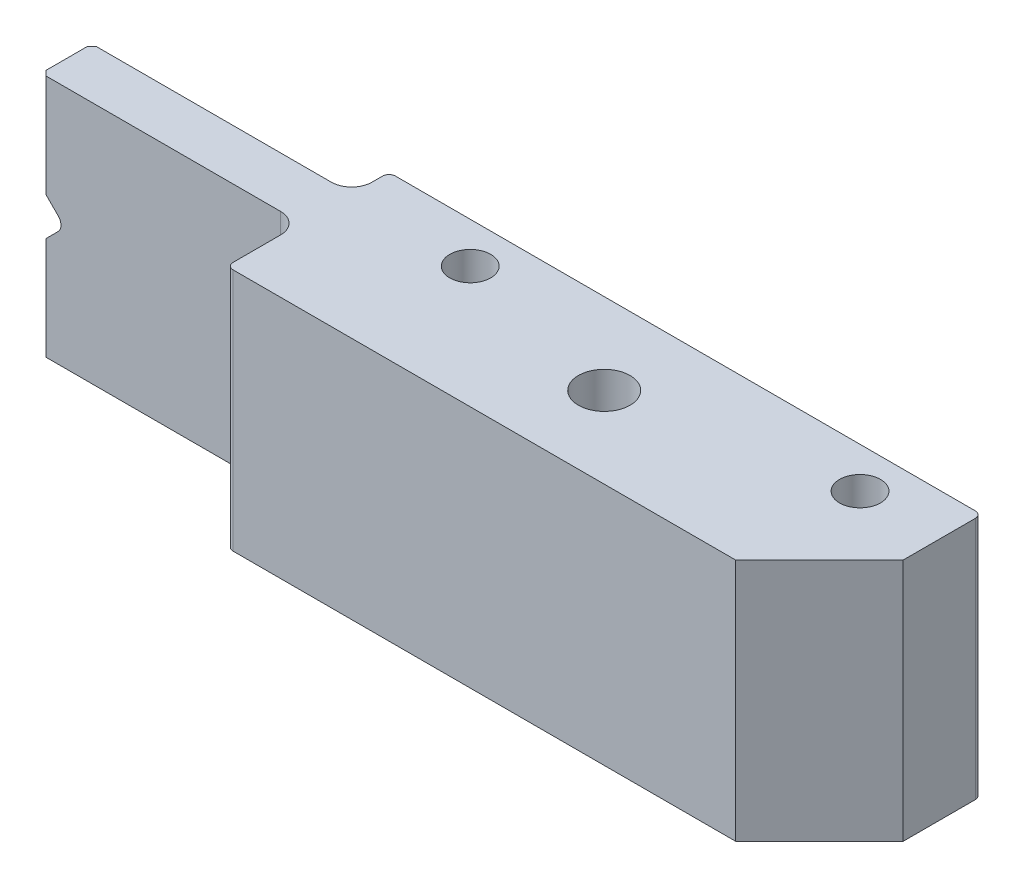
from build123d import *

# Parameters (mm, degrees)
CROQUIS1_W                          = 66.675
CROQUIS1_H                          = 19.05
SALIENTE_EXTRUIR1_DEPTH             = 12.7
CROQUIS2_W                          = 20.32
CROQUIS2_H                          = 2.921
CROQUIS2_H_2                        = 5.8166
CORTAR_EXTRUIR1_DEPTH               = 71.496440513
REDONDEO1_R                         = 1.5875
TALADROS_DE_ESPIGA_DE_1_8_0_126_1_D = 3.2004
TALADRO_ROSCADO_10_321_D            = 4.0386
CORTAR_EXTRUIR2_DEPTH               = 71.496440513
CORTAR_EXTRUIR3_DEPTH               = 71.02918653
CROQUIS10_W                         = 1.346153846
CROQUIS10_H                         = 0.358974359
CORTAR_EXTRUIR4_DEPTH               = 0.381
REDONDEO2_R                         = 0.508
CHAFL_N1_SIZE                       = 0.381


with BuildPart() as part:
    # Croquis1 → Saliente-Extruir1 (new body)
    with BuildSketch(Plane.XY):
        with Locations((33.3375, -9.525)):
            Rectangle(CROQUIS1_W, CROQUIS1_H)
    extrude(amount=SALIENTE_EXTRUIR1_DEPTH)

    # Croquis2 → Cortar-Extruir1 (cut, through all)
    with BuildSketch(Plane(origin=(0, 0, 0), x_dir=(1, 0, 0), z_dir=(0, 1, 0))):
        with Locations((10.16, -1.4605)):
            Rectangle(CROQUIS2_W, CROQUIS2_H)
        with Locations((10.16, -9.7917)):
            Rectangle(CROQUIS2_W, CROQUIS2_H_2)
    extrude(amount=-CORTAR_EXTRUIR1_DEPTH, mode=Mode.SUBTRACT)

    # Redondeo1
    redondeo1_edges = [part.edges().sort_by_distance(p)[0] for p in [
        (20.32, -9.525, 2.921),
        (20.32, -9.525, 6.8834),
    ]]
    fillet(redondeo1_edges, radius=REDONDEO1_R)

    # Taladros de espiga de 1/8 (0.126)1 (through all)
    with Locations(Plane(origin=(0, 0, 0), x_dir=(1, 0, 0), z_dir=(0, 1, 0))):
        with Locations((60.325, -3.175), (29.845, -3.175)):
            Hole(TALADROS_DE_ESPIGA_DE_1_8_0_126_1_D / 2)

    # Taladro roscado #10-321 (through all)
    with Locations(Plane(origin=(0, 0, 0), x_dir=(1, 0, 0), z_dir=(0, 1, 0))):
        with Locations((43.4975, -6.35)):
            Hole(TALADRO_ROSCADO_10_321_D / 2)

    # Croquis7 → Cortar-Extruir2 (cut, through all)
    with BuildSketch(Plane(origin=(0, 0, 0), x_dir=(1, 0, 0), z_dir=(0, 1, 0))):
        Polygon((66.675, -6.1468), (60.1218, -12.7), (66.675, -12.7), align=None)
    extrude(amount=-CORTAR_EXTRUIR2_DEPTH, mode=Mode.SUBTRACT)

    # Croquis8 → Cortar-Extruir3 (cut, through all)
    with BuildSketch(Plane(origin=(0, 0, 2.921), x_dir=(-1, 0, 0), z_dir=(0, 0, -1))):
        with BuildLine():
            Line((0, -7.659969265), (-1.326215367, -8.986184633))
            ThreePointArc((-1.326215367, -8.986184633), (-1.5494, -9.525), (-1.326215367, -10.063815367))
            Line((-1.326215367, -10.063815367), (0, -11.390030735))
            Line((0, -11.390030735), (0, -7.659969265))
        make_face()
    extrude(amount=-CORTAR_EXTRUIR3_DEPTH, mode=Mode.SUBTRACT)

    # Croquis10 → Cortar-Extruir4 (cut)
    # profile 1 of 12: a face of its own
    with BuildSketch(Plane(origin=(0, 0, 0), x_dir=(-1, 0, 0), z_dir=(0, 0, -1))):
        Polygon((-61.432842809, -12.7), (-60.970803546, -9.2), (-60.925931751, -9.2), (-59.480919732, -12.071794872), (-58.039413321, -9.2), (-57.993840405, -9.2), (-57.528996655, -12.7), (-57.844501463, -12.7), (-58.17963768, -10.181570513), (-59.443059155, -12.7), (-59.513872456, -12.7), (-60.782201783, -10.175961538), (-61.116636879, -12.7), align=None)
    # profile 2 of 12: a face of its own
    with BuildSketch(Plane(origin=(0, 0, 0), x_dir=(-1, 0, 0), z_dir=(0, 0, -1))):
        Polygon((-56.990535116, -12.7), (-56.528495854, -9.2), (-56.483624059, -9.2), (-55.038612039, -12.071794872), (-53.597105629, -9.2), (-53.551532713, -9.2), (-53.086688963, -12.7), (-53.40219377, -12.7), (-53.737329988, -10.181570513), (-55.000751463, -12.7), (-55.071564764, -12.7), (-56.339894091, -10.175961538), (-56.674329187, -12.7), align=None)
    # profile 3 of 12: a face of its own
    with BuildSketch(Plane(origin=(0, 0, 0), x_dir=(-1, 0, 0), z_dir=(0, 0, -1))):
        with BuildLine():
            Line((-50.57386845, -12.78974359), (-50.824870052, -12.615164263))
            Line((-50.824870052, -12.615164263), (-49.851713001, -11.192588141))
            add(Edge.make_bspline(
                [(-49.851713001, -11.192588141), (-49.913803737, -11.200181204), (-50.036063857, -11.215132369), (-50.159200959, -11.217879024), (-50.219801943, -11.219230769)],
                knots=[0, 0, 0, 0, 1.015715272, 2, 2, 2, 2], degree=3))
            add(Edge.make_bspline(
                [(-50.219801943, -11.219230769), (-50.256543991, -11.218289693), (-50.328665418, -11.216442442), (-50.43469707, -11.201800634), (-50.536582631, -11.179250506), (-50.634051987, -11.145601751), (-50.727471492, -11.103783542), (-50.816637205, -11.051926528), (-50.901429096, -10.990920237), (-50.980936506, -10.921087245), (-51.053248245, -10.844409193), (-51.117671542, -10.76325355), (-51.171212674, -10.676677579), (-51.21568926, -10.586447359), (-51.249419713, -10.491266009), (-51.273982251, -10.392216608), (-51.289104605, -10.288604966), (-51.290903701, -10.218079836), (-51.291817168, -10.182271635)],
                knots=[0, 0, 0, 0, 1.060718605, 2.082097864, 3.085795603, 4.069760067, 5.054557537, 6.03741023, 7.043284206, 8.066802108, 9.088538119, 10.083643548, 11.053783639, 12.022749082, 12.983451788, 13.964007469, 14.966251758, 16, 16, 16, 16], degree=3))
            add(Edge.make_bspline(
                [(-51.291817168, -10.182271635), (-51.290082733, -10.133302982), (-51.286678389, -10.03718745), (-51.259279872, -9.896753681), (-51.214219533, -9.763967138), (-51.151391156, -9.639176944), (-51.072256435, -9.524178205), (-50.977147844, -9.420569595), (-50.86664388, -9.329824742), (-50.743261861, -9.251820664), (-50.60990884, -9.189085667), (-50.470240182, -9.142846366), (-50.325326062, -9.115647619), (-50.227158392, -9.112061757), (-50.177734636, -9.11025641)],
                knots=[0, 0, 0, 0, 1.022988612, 2.007919123, 2.978103895, 3.94594894, 4.918897164, 5.887013414, 6.875921846, 7.89917871, 8.930658928, 9.948724884, 10.967259574, 12, 12, 12, 12], degree=3))
            add(Edge.make_bspline(
                [(-50.177734636, -9.11025641), (-50.129246216, -9.112086573), (-50.033437669, -9.115702803), (-49.892548663, -9.142186772), (-49.757607646, -9.186823445), (-49.629362659, -9.248508009), (-49.510623247, -9.325828916), (-49.403847436, -9.41796344), (-49.311471896, -9.524968967), (-49.233648016, -9.644257457), (-49.171177975, -9.772424439), (-49.126105692, -9.906208361), (-49.098360053, -10.044647082), (-49.094863726, -10.138441556), (-49.093099219, -10.185777244)],
                knots=[0, 0, 0, 0, 1.026385292, 2.028040595, 3.023318987, 4.028184125, 5.03290303, 6.015178782, 7.004435299, 8.016004309, 9.023023918, 10.015172535, 10.998308025, 12, 12, 12, 12], degree=3))
            add(Edge.make_bspline(
                [(-49.093099219, -10.185777244), (-49.094277628, -10.222521011), (-49.096667736, -10.297046551), (-49.113404043, -10.410276894), (-49.141824228, -10.525728124), (-49.174075927, -10.623449719), (-49.205208094, -10.704158169), (-49.234509226, -10.767909749), (-49.26702138, -10.835011013), (-49.304940145, -10.90475835), (-49.345702442, -10.978040885), (-49.391761718, -11.054123601), (-49.44206729, -11.133108594), (-49.47789701, -11.186355682), (-49.496244251, -11.213621795)],
                knots=[0, 0, 0, 0, 1.179839688, 2.393009684, 3.667231171, 4.993948276, 5.694988576, 6.444077775, 7.246288328, 8.089075292, 8.993003841, 9.939041771, 10.944649915, 12, 12, 12, 12], degree=3))
            Line((-49.496244251, -11.213621795), (-50.57386845, -12.78974359))
        make_face()
        with BuildLine():
            add(Edge.make_bspline(
                [(-50.161608834, -10.86025641), (-50.13377482, -10.859496026), (-50.079591457, -10.858015818), (-50.000214158, -10.849006576), (-49.925289955, -10.83303259), (-49.854618705, -10.810112878), (-49.787491803, -10.782456209), (-49.724975475, -10.747244223), (-49.6670174, -10.705227588), (-49.613229473, -10.658017572), (-49.565465473, -10.605566989), (-49.522922443, -10.550669882), (-49.486761875, -10.493085272), (-49.458198598, -10.43209201), (-49.434714023, -10.369174801), (-49.418496011, -10.303320446), (-49.409511677, -10.234872045), (-49.407980102, -10.188373387), (-49.407201783, -10.16474359)],
                knots=[0, 0, 0, 0, 1.163407946, 2.26475976, 3.333800367, 4.359385343, 5.366239384, 6.363380779, 7.350133999, 8.353570782, 9.349036268, 10.310270964, 11.253520213, 12.184142, 13.120487599, 14.056272588, 15.012232024, 16, 16, 16, 16], degree=3))
            add(Edge.make_bspline(
                [(-49.407201783, -10.16474359), (-49.407871452, -10.141103925), (-49.409191117, -10.094519065), (-49.419778417, -10.025969325), (-49.43840364, -9.960276064), (-49.463394125, -9.897079634), (-49.496314363, -9.836899262), (-49.535817849, -9.77897939), (-49.582750298, -9.723687262), (-49.636752865, -9.672323279), (-49.694987418, -9.62497538), (-49.757047918, -9.583189304), (-49.822422834, -9.548168107), (-49.890713324, -9.519269137), (-49.962061673, -9.496717362), (-50.036425661, -9.480499997), (-50.114181066, -9.471528243), (-50.166962352, -9.470006348), (-50.193860437, -9.469230769)],
                knots=[0, 0, 0, 0, 0.972161553, 1.915763587, 2.844109794, 3.775983486, 4.705125789, 5.659731448, 6.655561913, 7.682237399, 8.721216875, 9.739758359, 10.754845918, 11.767244016, 12.7857855, 13.828538656, 14.893392813, 16, 16, 16, 16], degree=3))
            add(Edge.make_bspline(
                [(-50.193860437, -9.469230769), (-50.22052459, -9.470007601), (-50.27283944, -9.471531738), (-50.349903599, -9.480482943), (-50.423764767, -9.496826428), (-50.494906387, -9.519258691), (-50.563194848, -9.548170263), (-50.62856668, -9.583191139), (-50.690641697, -9.624965761), (-50.748820418, -9.672360533), (-50.80291834, -9.72344818), (-50.849043869, -9.779221608), (-50.888637761, -9.836869133), (-50.921512764, -9.897087641), (-50.946515281, -9.960273927), (-50.965137283, -10.025969904), (-50.975725448, -10.094518914), (-50.977044995, -10.141103874), (-50.977714604, -10.16474359)],
                knots=[0, 0, 0, 0, 1.099389452, 2.15699305, 3.192601482, 4.213358962, 5.227959689, 6.245255729, 7.266013209, 8.307253147, 9.336162325, 10.327954924, 11.284637477, 12.215801273, 13.149702402, 14.080068371, 15.025723358, 16, 16, 16, 16], degree=3))
            add(Edge.make_bspline(
                [(-50.977714604, -10.16474359), (-50.977108677, -10.188391788), (-50.97591368, -10.235030365), (-50.964385891, -10.303556758), (-50.945107611, -10.369244952), (-50.91928822, -10.432733659), (-50.88528663, -10.493405517), (-50.843562782, -10.550972879), (-50.794657236, -10.606088329), (-50.739223748, -10.657895541), (-50.678555587, -10.705447716), (-50.613758841, -10.746978098), (-50.545949004, -10.782050543), (-50.474887374, -10.810191927), (-50.401100574, -10.83280359), (-50.323925442, -10.848977135), (-50.243617205, -10.857929402), (-50.189207223, -10.859473299), (-50.161608834, -10.86025641)],
                knots=[0, 0, 0, 0, 0.952633368, 1.87876736, 2.791047057, 3.707742249, 4.635551637, 5.587206343, 6.568248508, 7.601284464, 8.641511608, 9.671105535, 10.699146789, 11.713763218, 12.747829548, 13.806491675, 14.887386225, 16, 16, 16, 16], degree=3))
        make_face(mode=Mode.SUBTRACT)
    # profile 4 of 12: a face of its own
    with BuildSketch(Plane(origin=(0, 0, 0), x_dir=(-1, 0, 0), z_dir=(0, 0, -1))):
        with BuildLine():
            add(Edge.make_bspline(
                [(-48.64438127, -10.951402244), (-48.644053252, -10.895304856), (-48.643416072, -10.786334872), (-48.636327651, -10.62755023), (-48.624552309, -10.478589941), (-48.608414936, -10.339446875), (-48.588776956, -10.21008511), (-48.562561469, -10.090850353), (-48.532748667, -9.981190746), (-48.498196221, -9.880748698), (-48.459208432, -9.788170995), (-48.416774171, -9.701745793), (-48.369209377, -9.621603861), (-48.319232464, -9.546466071), (-48.264820392, -9.477562376), (-48.207521602, -9.413919713), (-48.145099725, -9.357008963), (-48.079676717, -9.305162661), (-48.010660253, -9.259713189), (-47.940017586, -9.21968045), (-47.867262481, -9.185480583), (-47.792196298, -9.158590147), (-47.71549374, -9.1363793), (-47.636886673, -9.121190353), (-47.556245309, -9.111633444), (-47.501813874, -9.110719776), (-47.474208995, -9.11025641)],
                knots=[0, 0, 0, 0, 1.646270934, 3.197905019, 4.663502075, 6.030701355, 7.308322542, 8.50163776, 9.611534131, 10.641858119, 11.616356847, 12.558055219, 13.465016945, 14.349605745, 15.204443733, 16.039544428, 16.859896111, 17.680448484, 18.487036065, 19.28249412, 20.06191084, 20.843045899, 21.620316918, 22.403196591, 23.190181807, 24, 24, 24, 24], degree=3))
            add(Edge.make_bspline(
                [(-47.474208995, -9.11025641), (-47.446373516, -9.110744225), (-47.391017507, -9.111714336), (-47.309177132, -9.121038279), (-47.22922745, -9.136509402), (-47.151509312, -9.158430377), (-47.075384325, -9.185626053), (-47.001447917, -9.21971317), (-46.929240836, -9.259392038), (-46.859910548, -9.306015915), (-46.792695933, -9.357998191), (-46.72924797, -9.41676086), (-46.669560884, -9.481710579), (-46.612885579, -9.552152443), (-46.560829981, -9.629437528), (-46.511256549, -9.712221638), (-46.466884513, -9.801952503), (-46.424149838, -9.89713297), (-46.387262851, -10.000396629), (-46.353996606, -10.11116139), (-46.327117638, -10.230735577), (-46.304728365, -10.358491822), (-46.287383469, -10.494899305), (-46.274750827, -10.639665621), (-46.268077742, -10.792886011), (-46.266821041, -10.89764386), (-46.266176142, -10.951402244)],
                knots=[0, 0, 0, 0, 0.810914788, 1.612654377, 2.396697861, 3.181598691, 3.963628158, 4.749916497, 5.551656086, 6.361998678, 7.18212741, 8.025565596, 8.878627764, 9.750805457, 10.657531673, 11.591944965, 12.560506719, 13.57287815, 14.630710178, 15.753379473, 16.941251878, 18.199788006, 19.531962791, 20.947069417, 22.433333509, 24, 24, 24, 24], degree=3))
            add(Edge.make_bspline(
                [(-46.266176142, -10.951402244), (-46.266827727, -11.004926152), (-46.268097312, -11.109215303), (-46.274676019, -11.261746279), (-46.28763465, -11.405744322), (-46.303844639, -11.541554784), (-46.326295602, -11.668612403), (-46.353900768, -11.787356852), (-46.384551091, -11.898300923), (-46.422385885, -12.000535735), (-46.463796595, -12.095487458), (-46.508851791, -12.184154606), (-46.557121617, -12.267320899), (-46.609710362, -12.344320646), (-46.665763776, -12.415699303), (-46.726481564, -12.480196926), (-46.79015215, -12.539367598), (-46.857564565, -12.592019225), (-46.927976117, -12.63810403), (-46.999935194, -12.67931788), (-47.074718577, -12.712550575), (-47.15063153, -12.741085616), (-47.228759896, -12.762886068), (-47.309006286, -12.777959923), (-47.390962522, -12.788531772), (-47.446364087, -12.789338252), (-47.474208995, -12.78974359)],
                knots=[0, 0, 0, 0, 1.561518951, 3.042555995, 4.452378317, 5.7783523, 7.031515105, 8.214008947, 9.334062868, 10.386615937, 11.391082383, 12.354592575, 13.286541444, 14.194233754, 15.072674879, 15.931287219, 16.775624067, 17.606195743, 18.42308326, 19.229000347, 20.022332153, 20.807536673, 21.593273796, 22.3848459, 23.188221202, 24, 24, 24, 24], degree=3))
            add(Edge.make_bspline(
                [(-47.474208995, -12.78974359), (-47.501813109, -12.789277234), (-47.556243033, -12.788357672), (-47.636895459, -12.778843941), (-47.715177902, -12.763548438), (-47.791476656, -12.742131834), (-47.866183171, -12.715916997), (-47.938279458, -12.681763314), (-48.008567142, -12.642429245), (-48.076858698, -12.597633823), (-48.141870859, -12.54631214), (-48.203969464, -12.489547851), (-48.261594483, -12.42592444), (-48.315228579, -12.356446517), (-48.366202667, -12.281753275), (-48.41309204, -12.200824902), (-48.456462894, -12.113982291), (-48.496106385, -12.02066438), (-48.531255049, -11.919509453), (-48.562302757, -11.809360274), (-48.586816914, -11.689244638), (-48.607799869, -11.560127271), (-48.624724252, -11.421453341), (-48.636278578, -11.273147562), (-48.643419893, -11.115302353), (-48.644054963, -11.007032579), (-48.64438127, -10.951402244)],
                knots=[0, 0, 0, 0, 0.810891512, 1.598919785, 2.382837074, 3.152667961, 3.926044502, 4.706494248, 5.493654104, 6.291793342, 7.103789334, 7.925228297, 8.761435821, 9.622817696, 10.50288917, 11.416980706, 12.369136599, 13.353924996, 14.394355917, 15.514179734, 16.714354668, 17.994756427, 19.357759367, 20.818452758, 22.365282078, 24, 24, 24, 24], degree=3))
        make_face()
        with BuildLine():
            add(Edge.make_bspline(
                [(-48.330278706, -10.95), (-48.330159259, -10.996748699), (-48.329927436, -11.087478744), (-48.323871235, -11.219322005), (-48.315621003, -11.342292333), (-48.304979706, -11.45654587), (-48.289176757, -11.561695882), (-48.27146997, -11.658465565), (-48.24992188, -11.746342803), (-48.224426862, -11.825930613), (-48.195387765, -11.898579682), (-48.163681902, -11.966180897), (-48.129621179, -12.029532833), (-48.091502028, -12.088066442), (-48.049986965, -12.141972606), (-48.006013706, -12.192205438), (-47.957941122, -12.237002419), (-47.891437379, -12.290729274), (-47.803640905, -12.346248408), (-47.693020449, -12.394594498), (-47.579351998, -12.424976954), (-47.502200748, -12.42884071), (-47.463692168, -12.430769231)],
                knots=[0, 0, 0, 0, 1.459021318, 2.831673884, 4.118529203, 5.306027144, 6.411944654, 7.436330062, 8.375795394, 9.233974572, 10.042671642, 10.816086306, 11.563610507, 12.285937304, 12.993564865, 13.685989202, 14.367179055, 15.041617293, 16.353048772, 17.594441528, 18.799311195, 20, 20, 20, 20], degree=3))
            add(Edge.make_bspline(
                [(-47.463692168, -12.430769231), (-47.424934496, -12.42917145), (-47.347499173, -12.425979187), (-47.234365378, -12.39518045), (-47.124535108, -12.34871091), (-47.038463167, -12.293763405), (-46.972980624, -12.241435075), (-46.926063634, -12.196820427), (-46.883001585, -12.14686456), (-46.84215951, -12.092965264), (-46.804700435, -12.03409278), (-46.770637297, -11.970530204), (-46.739553949, -11.902101027), (-46.721844904, -11.854331287), (-46.712790725, -11.829907853)],
                knots=[0, 0, 0, 0, 1.353760809, 2.704726607, 4.075137775, 5.516104923, 6.260822281, 7.007110065, 7.778089737, 8.566572457, 9.372053459, 10.217411131, 11.088608312, 12, 12, 12, 12], degree=3))
            add(Edge.make_bspline(
                [(-46.712790725, -11.829907853), (-46.702238958, -11.798678113), (-46.680814344, -11.735268349), (-46.653202569, -11.636904697), (-46.63145717, -11.533701933), (-46.611893804, -11.426276816), (-46.598540749, -11.313837115), (-46.587792935, -11.196730731), (-46.581462248, -11.074869369), (-46.580677497, -10.992074378), (-46.580278706, -10.95)],
                knots=[0, 0, 0, 0, 0.884706709, 1.796334032, 2.740027952, 3.714592787, 4.726048262, 5.777819803, 6.87074269, 8, 8, 8, 8], degree=3))
            add(Edge.make_bspline(
                [(-46.580278706, -10.95), (-46.580828895, -10.907932427), (-46.581905183, -10.825639263), (-46.586019171, -10.705121082), (-46.596642745, -10.590653321), (-46.608441864, -10.481742848), (-46.625839085, -10.378992546), (-46.644596892, -10.281542241), (-46.669798104, -10.190599216), (-46.696717879, -10.104739634), (-46.727528275, -10.024938979), (-46.761444009, -9.950825193), (-46.797665768, -9.882040468), (-46.837008008, -9.818773527), (-46.879003691, -9.760740984), (-46.924761241, -9.709106389), (-46.972465613, -9.662269421), (-47.039282799, -9.608806852), (-47.126757089, -9.554295157), (-47.235602736, -9.504129397), (-47.348873381, -9.475321104), (-47.425446835, -9.471259417), (-47.463692168, -9.469230769)],
                knots=[0, 0, 0, 0, 1.31362396, 2.569729283, 3.763502607, 4.902122613, 5.988968491, 7.01645872, 7.998833611, 8.933434873, 9.825090667, 10.667526885, 11.477055099, 12.250526234, 12.991942729, 13.710640831, 14.402115721, 15.076753259, 16.378508321, 17.609869233, 18.806226677, 20, 20, 20, 20], degree=3))
            add(Edge.make_bspline(
                [(-47.463692168, -9.469230769), (-47.50240276, -9.471262216), (-47.579894465, -9.47532881), (-47.69434242, -9.504022064), (-47.804046772, -9.55403503), (-47.891289746, -9.608987402), (-47.958153533, -9.661325713), (-48.005236226, -9.706712167), (-48.049382398, -9.756358422), (-48.090050099, -9.810760337), (-48.128139382, -9.869225704), (-48.163120394, -9.932214469), (-48.194637724, -10.000045833), (-48.22372226, -10.072662268), (-48.249295048, -10.152243213), (-48.270389012, -10.240012206), (-48.289876065, -10.336474098), (-48.303671334, -10.442193606), (-48.315935089, -10.55647576), (-48.323816437, -10.679753078), (-48.329947695, -10.811817458), (-48.330166159, -10.903016617), (-48.330278706, -10.95)],
                knots=[0, 0, 0, 0, 1.207732386, 2.417664972, 3.655092373, 4.956220595, 5.625982001, 6.301752483, 6.994047911, 7.697131622, 8.419323945, 9.170223765, 9.943494443, 10.752040957, 11.610060368, 12.549350801, 13.567764191, 14.679664412, 15.874934091, 17.154273443, 18.533957287, 20, 20, 20, 20], degree=3))
        make_face(mode=Mode.SUBTRACT)
    # profile 5 of 12: a face of its own
    with BuildSketch(Plane(origin=(0, 0, 0), x_dir=(-1, 0, 0), z_dir=(0, 0, -1))):
        with Locations((-45.278996655, -11.353846154)):
            Rectangle(CROQUIS10_W, CROQUIS10_H)
    # profile 6 of 12: a face of its own
    with BuildSketch(Plane(origin=(0, 0, 0), x_dir=(-1, 0, 0), z_dir=(0, 0, -1))):
        Polygon((-42.426132071, -9.11025641), (-42.362329988, -9.11025641), (-42.362329988, -11.533333333), (-41.958483834, -11.533333333), (-41.958483834, -11.892307692), (-42.362329988, -11.892307692), (-42.362329988, -12.7), (-42.676432552, -12.7), (-42.676432552, -11.892307692), (-44.336688963, -11.892307692), align=None)
        Polygon((-42.676432552, -11.533333333), (-42.676432552, -10.013301282), (-43.719701783, -11.533333333), align=None, mode=Mode.SUBTRACT)
    # profile 7 of 12: a face of its own
    with BuildSketch(Plane(origin=(0, 0, 0), x_dir=(-1, 0, 0), z_dir=(0, 0, -1))):
        Polygon((-40.900491046, -9.2), (-40.253355629, -9.2), (-40.253355629, -12.7), (-40.567458193, -12.7), (-40.567458193, -9.558974359), (-41.105919732, -9.558974359), align=None)
    # profile 8 of 12: a face of its own
    with BuildSketch(Plane(origin=(0, 0, 0), x_dir=(-1, 0, 0), z_dir=(0, 0, -1))):
        with BuildLine():
            Line((-36.753355629, -9.2), (-36.753355629, -9.558974359))
            Line((-36.753355629, -9.558974359), (-37.943860437, -9.558974359))
            Line((-37.943860437, -9.558974359), (-38.1324622, -10.479547276))
            add(Edge.make_bspline(
                [(-38.1324622, -10.479547276), (-38.095406325, -10.469317004), (-38.023616429, -10.44949747), (-37.917656569, -10.4274917), (-37.817064365, -10.414226256), (-37.751788995, -10.412414945), (-37.720202584, -10.411538462)],
                knots=[0, 0, 0, 0, 1.100273476, 2.13160584, 3.095893838, 4, 4, 4, 4], degree=3))
            add(Edge.make_bspline(
                [(-37.720202584, -10.411538462), (-37.681118845, -10.412384397), (-37.604270447, -10.414047718), (-37.4918315, -10.430019568), (-37.384498607, -10.455159482), (-37.282496237, -10.490280004), (-37.185635686, -10.535189737), (-37.094808125, -10.591289678), (-37.008650212, -10.656823009), (-36.928707618, -10.732168021), (-36.85618331, -10.815089637), (-36.79241732, -10.904247508), (-36.73825473, -10.998775171), (-36.694693975, -11.099575779), (-36.659909641, -11.205534933), (-36.636757646, -11.317767515), (-36.621340937, -11.435215635), (-36.61961855, -11.515520205), (-36.618740245, -11.556470353)],
                knots=[0, 0, 0, 0, 1.052922333, 2.070308379, 3.05430497, 4.020497103, 4.973039431, 5.925935799, 6.892292201, 7.88610001, 8.88166317, 9.857072816, 10.836096531, 11.812156883, 12.81219415, 13.836441305, 14.89672472, 16, 16, 16, 16], degree=3))
            add(Edge.make_bspline(
                [(-36.618740245, -11.556470353), (-36.61940532, -11.584992573), (-36.620726482, -11.64165156), (-36.62744507, -11.725795761), (-36.640380786, -11.808158594), (-36.65774851, -11.888750986), (-36.680290928, -11.967420358), (-36.707579982, -12.044391886), (-36.74097601, -12.119186493), (-36.777607385, -12.192511888), (-36.818853863, -12.262710395), (-36.86463237, -12.328359382), (-36.912997862, -12.390443663), (-36.965039247, -12.448297396), (-37.021240242, -12.501540414), (-37.080920209, -12.550488696), (-37.143602928, -12.595970026), (-37.21025817, -12.636138221), (-37.279400653, -12.673101177), (-37.35202887, -12.703424715), (-37.426489571, -12.730535243), (-37.503854446, -12.75214477), (-37.583948259, -12.769077325), (-37.666903035, -12.780577925), (-37.752283705, -12.788954363), (-37.810158717, -12.78947872), (-37.839393289, -12.78974359)],
                knots=[0, 0, 0, 0, 1.056347294, 2.098418968, 3.122841568, 4.141288669, 5.149314143, 6.15115421, 7.162517403, 8.180376062, 9.185164535, 10.17417709, 11.141909838, 12.097768115, 13.052685741, 14.0056014, 14.954263652, 15.917497458, 16.885230207, 17.854509472, 18.828990115, 19.81800267, 20.826176721, 21.857883937, 22.917946725, 24, 24, 24, 24], degree=3))
            add(Edge.make_bspline(
                [(-37.839393289, -12.78974359), (-37.87426747, -12.789052752), (-37.942878301, -12.78769361), (-38.043398868, -12.773475124), (-38.140113474, -12.753111208), (-38.232243575, -12.722474938), (-38.320614838, -12.684087643), (-38.404037556, -12.635571472), (-38.484643332, -12.580592368), (-38.559155369, -12.515712015), (-38.628311483, -12.444796333), (-38.690217991, -12.367838692), (-38.745351568, -12.28610925), (-38.792829315, -12.199211096), (-38.833327336, -12.107372565), (-38.865142325, -12.010249564), (-38.89082068, -11.90834956), (-38.9016841, -11.83819605), (-38.907201783, -11.802564103)],
                knots=[0, 0, 0, 0, 1.0467383, 2.05933395, 3.04377827, 4.011590433, 4.970194871, 5.932262533, 6.905835911, 7.896367577, 8.894135286, 9.877477877, 10.858688626, 11.851381753, 12.8477658, 13.868841284, 14.917554742, 16, 16, 16, 16], degree=3))
            Line((-38.907201783, -11.802564103), (-38.593099219, -11.802564103))
            add(Edge.make_bspline(
                [(-38.593099219, -11.802564103), (-38.585370662, -11.835940555), (-38.570515945, -11.90009195), (-38.537910196, -11.990223291), (-38.498044321, -12.070542515), (-38.450639972, -12.142112098), (-38.394089942, -12.204521095), (-38.329560513, -12.260138157), (-38.25721279, -12.310313287), (-38.17681956, -12.352136054), (-38.092006481, -12.387804807), (-38.003239271, -12.411556502), (-37.912934925, -12.428257395), (-37.851856554, -12.429929156), (-37.821164123, -12.430769231)],
                knots=[0, 0, 0, 0, 1.136247022, 2.183929868, 3.172523383, 4.106158343, 5.02341133, 5.958108904, 6.928429099, 7.938127109, 8.96079061, 9.975095812, 10.982467395, 12, 12, 12, 12], degree=3))
            add(Edge.make_bspline(
                [(-37.821164123, -12.430769231), (-37.791205678, -12.429948453), (-37.732217256, -12.428332334), (-37.645405869, -12.415893322), (-37.561592995, -12.396735751), (-37.481605639, -12.368065896), (-37.404044099, -12.333221178), (-37.330870329, -12.288506102), (-37.259967451, -12.237046083), (-37.193539318, -12.178089453), (-37.132699869, -12.113119759), (-37.078943747, -12.043642365), (-37.034166834, -11.969525519), (-36.996432725, -11.892052366), (-36.967779426, -11.810373809), (-36.947338445, -11.724872634), (-36.935335386, -11.635337653), (-36.933684206, -11.574268344), (-36.932842809, -11.543149038)],
                knots=[0, 0, 0, 0, 1.027316725, 2.022795036, 3.002884548, 3.971462791, 4.93288096, 5.914575861, 6.907176829, 7.935150275, 8.956128384, 9.956726525, 10.942570165, 11.921478529, 12.907843606, 13.90538589, 14.932640048, 16, 16, 16, 16], degree=3))
            add(Edge.make_bspline(
                [(-36.932842809, -11.543149038), (-36.933501288, -11.515073287), (-36.934790168, -11.460118998), (-36.945320738, -11.379719791), (-36.963637711, -11.303646749), (-36.989061591, -11.231532515), (-37.021341098, -11.163309073), (-37.060787411, -11.098906013), (-37.108140809, -11.039172179), (-37.162232697, -10.984079626), (-37.221490738, -10.933234751), (-37.286934481, -10.889890664), (-37.357194408, -10.853426747), (-37.431424007, -10.821958748), (-37.511388906, -10.799358003), (-37.595505538, -10.782390118), (-37.684682246, -10.772574755), (-37.745652934, -10.771212866), (-37.77699345, -10.770512821)],
                knots=[0, 0, 0, 0, 1.045622112, 2.046656509, 3.013763289, 3.955457236, 4.890082067, 5.820317437, 6.762574623, 7.722996705, 8.69280354, 9.665887285, 10.63943826, 11.638615906, 12.663482002, 13.728887084, 14.832589034, 16, 16, 16, 16], degree=3))
            add(Edge.make_bspline(
                [(-37.77699345, -10.770512821), (-37.804122379, -10.771093412), (-37.860136734, -10.772292185), (-37.946059561, -10.781118682), (-38.036351284, -10.795357976), (-38.130665779, -10.814944224), (-38.229286287, -10.840575301), (-38.332004688, -10.871289801), (-38.439036955, -10.9080118), (-38.511154679, -10.935744014), (-38.548227424, -10.95)],
                knots=[0, 0, 0, 0, 0.817624296, 1.688186739, 2.600797293, 3.572016777, 4.590301741, 5.671205678, 6.80286297, 8, 8, 8, 8], degree=3))
            Line((-38.548227424, -10.95), (-38.189253065, -9.2))
            Line((-38.189253065, -9.2), (-36.753355629, -9.2))
        make_face()
    # profile 9 of 12: a face of its own
    with BuildSketch(Plane(origin=(0, 0, 0), x_dir=(-1, 0, 0), z_dir=(0, 0, -1))):
        with BuildLine():
            add(Edge.make_bspline(
                [(-36.259765886, -10.951402244), (-36.259437867, -10.895304856), (-36.258800687, -10.786334872), (-36.251712266, -10.62755023), (-36.239936924, -10.478589941), (-36.223799551, -10.339446875), (-36.204161571, -10.21008511), (-36.177946085, -10.090850353), (-36.148133282, -9.981190746), (-36.113580836, -9.880748698), (-36.074593047, -9.788170995), (-36.032158786, -9.701745793), (-35.984593992, -9.621603861), (-35.934617079, -9.546466071), (-35.880205007, -9.477562376), (-35.822906217, -9.413919713), (-35.760484341, -9.357008963), (-35.695061332, -9.305162661), (-35.626044868, -9.259713189), (-35.555402202, -9.21968045), (-35.482647096, -9.185480583), (-35.407580913, -9.158590147), (-35.330878355, -9.1363793), (-35.252271288, -9.121190353), (-35.171629925, -9.111633444), (-35.11719849, -9.110719776), (-35.08959361, -9.11025641)],
                knots=[0, 0, 0, 0, 1.646270934, 3.197905019, 4.663502075, 6.030701355, 7.308322542, 8.50163776, 9.611534131, 10.641858119, 11.616356847, 12.558055219, 13.465016945, 14.349605745, 15.204443733, 16.039544428, 16.859896111, 17.680448484, 18.487036065, 19.28249412, 20.06191084, 20.843045899, 21.620316918, 22.403196591, 23.190181807, 24, 24, 24, 24], degree=3))
            add(Edge.make_bspline(
                [(-35.08959361, -9.11025641), (-35.061758131, -9.110744225), (-35.006402123, -9.111714336), (-34.924561747, -9.121038279), (-34.844612066, -9.136509402), (-34.766893927, -9.158430377), (-34.69076894, -9.185626053), (-34.616832533, -9.21971317), (-34.544625451, -9.259392038), (-34.475295164, -9.306015915), (-34.408080548, -9.357998191), (-34.344632585, -9.41676086), (-34.284945499, -9.481710579), (-34.228270194, -9.552152443), (-34.176214597, -9.629437528), (-34.126641165, -9.712221638), (-34.082269129, -9.801952503), (-34.039534454, -9.89713297), (-34.002647467, -10.000396629), (-33.969381222, -10.11116139), (-33.942502253, -10.230735577), (-33.920112981, -10.358491822), (-33.902768085, -10.494899305), (-33.890135443, -10.639665621), (-33.883462358, -10.792886011), (-33.882205656, -10.89764386), (-33.881560757, -10.951402244)],
                knots=[0, 0, 0, 0, 0.810914788, 1.612654377, 2.396697861, 3.181598691, 3.963628158, 4.749916497, 5.551656086, 6.361998678, 7.18212741, 8.025565596, 8.878627764, 9.750805457, 10.657531673, 11.591944965, 12.560506719, 13.57287815, 14.630710178, 15.753379473, 16.941251878, 18.199788006, 19.531962791, 20.947069417, 22.433333509, 24, 24, 24, 24], degree=3))
            add(Edge.make_bspline(
                [(-33.881560757, -10.951402244), (-33.882212342, -11.004926152), (-33.883481928, -11.109215303), (-33.890060635, -11.261746279), (-33.903019266, -11.405744322), (-33.919229254, -11.541554784), (-33.941680217, -11.668612403), (-33.969285383, -11.787356852), (-33.999935706, -11.898300923), (-34.0377705, -12.000535735), (-34.079181211, -12.095487458), (-34.124236407, -12.184154606), (-34.172506233, -12.267320899), (-34.225094978, -12.344320646), (-34.281148391, -12.415699303), (-34.34186618, -12.480196926), (-34.405536765, -12.539367598), (-34.472949181, -12.592019225), (-34.543360732, -12.63810403), (-34.615319809, -12.67931788), (-34.690103192, -12.712550575), (-34.766016145, -12.741085616), (-34.844144511, -12.762886068), (-34.924390902, -12.777959923), (-35.006347138, -12.788531772), (-35.061748703, -12.789338252), (-35.08959361, -12.78974359)],
                knots=[0, 0, 0, 0, 1.561518951, 3.042555995, 4.452378317, 5.7783523, 7.031515105, 8.214008947, 9.334062868, 10.386615937, 11.391082383, 12.354592575, 13.286541444, 14.194233754, 15.072674879, 15.931287219, 16.775624067, 17.606195743, 18.42308326, 19.229000347, 20.022332153, 20.807536673, 21.593273796, 22.3848459, 23.188221202, 24, 24, 24, 24], degree=3))
            add(Edge.make_bspline(
                [(-35.08959361, -12.78974359), (-35.117197724, -12.789277234), (-35.171627649, -12.788357672), (-35.252280074, -12.778843941), (-35.330562518, -12.763548438), (-35.406861272, -12.742131834), (-35.481567787, -12.715916997), (-35.553664073, -12.681763314), (-35.623951757, -12.642429245), (-35.692243313, -12.597633823), (-35.757255474, -12.54631214), (-35.819354079, -12.489547851), (-35.876979099, -12.42592444), (-35.930613194, -12.356446517), (-35.981587282, -12.281753275), (-36.028476656, -12.200824902), (-36.07184751, -12.113982291), (-36.111491, -12.02066438), (-36.146639664, -11.919509453), (-36.177687372, -11.809360274), (-36.202201529, -11.689244638), (-36.223184485, -11.560127271), (-36.240108868, -11.421453341), (-36.251663193, -11.273147562), (-36.258804508, -11.115302353), (-36.259439579, -11.007032579), (-36.259765886, -10.951402244)],
                knots=[0, 0, 0, 0, 0.810891512, 1.598919785, 2.382837074, 3.152667961, 3.926044502, 4.706494248, 5.493654104, 6.291793342, 7.103789334, 7.925228297, 8.761435821, 9.622817696, 10.50288917, 11.416980706, 12.369136599, 13.353924996, 14.394355917, 15.514179734, 16.714354668, 17.994756427, 19.357759367, 20.818452758, 22.365282078, 24, 24, 24, 24], degree=3))
        make_face()
        with BuildLine():
            add(Edge.make_bspline(
                [(-35.945663321, -10.95), (-35.945543874, -10.996748699), (-35.945312051, -11.087478744), (-35.939255851, -11.219322005), (-35.931005619, -11.342292333), (-35.920364321, -11.45654587), (-35.904561373, -11.561695882), (-35.886854585, -11.658465565), (-35.865306495, -11.746342803), (-35.839811478, -11.825930613), (-35.810772381, -11.898579682), (-35.779066517, -11.966180897), (-35.745005794, -12.029532833), (-35.706886644, -12.088066442), (-35.66537158, -12.141972606), (-35.621398321, -12.192205438), (-35.573325737, -12.237002419), (-35.506821994, -12.290729274), (-35.41902552, -12.346248408), (-35.308405065, -12.394594498), (-35.194736614, -12.424976954), (-35.117585364, -12.42884071), (-35.079076783, -12.430769231)],
                knots=[0, 0, 0, 0, 1.459021318, 2.831673884, 4.118529203, 5.306027144, 6.411944654, 7.436330062, 8.375795394, 9.233974572, 10.042671642, 10.816086306, 11.563610507, 12.285937304, 12.993564865, 13.685989202, 14.367179055, 15.041617293, 16.353048772, 17.594441528, 18.799311195, 20, 20, 20, 20], degree=3))
            add(Edge.make_bspline(
                [(-35.079076783, -12.430769231), (-35.040319111, -12.42917145), (-34.962883788, -12.425979187), (-34.849749993, -12.39518045), (-34.739919723, -12.34871091), (-34.653847783, -12.293763405), (-34.588365239, -12.241435075), (-34.541448249, -12.196820427), (-34.498386201, -12.14686456), (-34.457544126, -12.092965264), (-34.42008505, -12.03409278), (-34.386021912, -11.970530204), (-34.354938565, -11.902101027), (-34.337229519, -11.854331287), (-34.328175341, -11.829907853)],
                knots=[0, 0, 0, 0, 1.353760809, 2.704726607, 4.075137775, 5.516104923, 6.260822281, 7.007110065, 7.778089737, 8.566572457, 9.372053459, 10.217411131, 11.088608312, 12, 12, 12, 12], degree=3))
            add(Edge.make_bspline(
                [(-34.328175341, -11.829907853), (-34.317623573, -11.798678113), (-34.296198959, -11.735268349), (-34.268587185, -11.636904697), (-34.246841786, -11.533701933), (-34.22727842, -11.426276816), (-34.213925364, -11.313837115), (-34.203177551, -11.196730731), (-34.196846864, -11.074869369), (-34.196062113, -10.992074378), (-34.195663321, -10.95)],
                knots=[0, 0, 0, 0, 0.884706709, 1.796334032, 2.740027952, 3.714592787, 4.726048262, 5.777819803, 6.87074269, 8, 8, 8, 8], degree=3))
            add(Edge.make_bspline(
                [(-34.195663321, -10.95), (-34.196213511, -10.907932427), (-34.197289798, -10.825639263), (-34.201403786, -10.705121082), (-34.212027361, -10.590653321), (-34.22382648, -10.481742848), (-34.241223701, -10.378992546), (-34.259981508, -10.281542241), (-34.28518272, -10.190599216), (-34.312102495, -10.104739634), (-34.34291289, -10.024938979), (-34.376828625, -9.950825193), (-34.413050383, -9.882040468), (-34.452392624, -9.818773527), (-34.494388307, -9.760740984), (-34.540145856, -9.709106389), (-34.587850229, -9.662269421), (-34.654667415, -9.608806852), (-34.742141704, -9.554295157), (-34.850987352, -9.504129397), (-34.964257996, -9.475321104), (-35.04083145, -9.471259417), (-35.079076783, -9.469230769)],
                knots=[0, 0, 0, 0, 1.31362396, 2.569729283, 3.763502607, 4.902122613, 5.988968491, 7.01645872, 7.998833611, 8.933434873, 9.825090667, 10.667526885, 11.477055099, 12.250526234, 12.991942729, 13.710640831, 14.402115721, 15.076753259, 16.378508321, 17.609869233, 18.806226677, 20, 20, 20, 20], degree=3))
            add(Edge.make_bspline(
                [(-35.079076783, -9.469230769), (-35.117787375, -9.471262216), (-35.195279081, -9.47532881), (-35.309727035, -9.504022064), (-35.419431387, -9.55403503), (-35.506674362, -9.608987402), (-35.573538148, -9.661325713), (-35.620620842, -9.706712167), (-35.664767014, -9.756358422), (-35.705434714, -9.810760337), (-35.743523997, -9.869225704), (-35.77850501, -9.932214469), (-35.810022339, -10.000045833), (-35.839106876, -10.072662268), (-35.864679664, -10.152243213), (-35.885773627, -10.240012206), (-35.90526068, -10.336474098), (-35.919055949, -10.442193606), (-35.931319705, -10.55647576), (-35.939201053, -10.679753078), (-35.94533231, -10.811817458), (-35.945550774, -10.903016617), (-35.945663321, -10.95)],
                knots=[0, 0, 0, 0, 1.207732386, 2.417664972, 3.655092373, 4.956220595, 5.625982001, 6.301752483, 6.994047911, 7.697131622, 8.419323945, 9.170223765, 9.943494443, 10.752040957, 11.610060368, 12.549350801, 13.567764191, 14.679664412, 15.874934091, 17.154273443, 18.533957287, 20, 20, 20, 20], degree=3))
        make_face(mode=Mode.SUBTRACT)
    # profile 10 of 12: a face of its own
    with BuildSketch(Plane(origin=(0, 0, 0), x_dir=(-1, 0, 0), z_dir=(0, 0, -1))):
        with Locations((-32.89438127, -11.353846154)):
            Rectangle(CROQUIS10_W, CROQUIS10_H)
    # profile 11 of 12: a face of its own
    with BuildSketch(Plane(origin=(0, 0, 0), x_dir=(-1, 0, 0), z_dir=(0, 0, -1))):
        with BuildLine():
            add(Edge.make_bspline(
                [(-31.952073578, -10.951402244), (-31.95174556, -10.895304856), (-31.95110838, -10.786334872), (-31.944019959, -10.62755023), (-31.932244616, -10.478589941), (-31.916107244, -10.339446875), (-31.896469263, -10.21008511), (-31.870253777, -10.090850353), (-31.840440974, -9.981190746), (-31.805888528, -9.880748698), (-31.766900739, -9.788170995), (-31.724466479, -9.701745793), (-31.676901684, -9.621603861), (-31.626924771, -9.546466071), (-31.5725127, -9.477562376), (-31.515213909, -9.413919713), (-31.452792033, -9.357008963), (-31.387369025, -9.305162661), (-31.31835256, -9.259713189), (-31.247709894, -9.21968045), (-31.174954788, -9.185480583), (-31.099888605, -9.158590147), (-31.023186047, -9.1363793), (-30.944578981, -9.121190353), (-30.863937617, -9.111633444), (-30.809506182, -9.110719776), (-30.781901302, -9.11025641)],
                knots=[0, 0, 0, 0, 1.646270934, 3.197905019, 4.663502075, 6.030701355, 7.308322542, 8.50163776, 9.611534131, 10.641858119, 11.616356847, 12.558055219, 13.465016945, 14.349605745, 15.204443733, 16.039544428, 16.859896111, 17.680448484, 18.487036065, 19.28249412, 20.06191084, 20.843045899, 21.620316918, 22.403196591, 23.190181807, 24, 24, 24, 24], degree=3))
            add(Edge.make_bspline(
                [(-30.781901302, -9.11025641), (-30.754065824, -9.110744225), (-30.698709815, -9.111714336), (-30.61686944, -9.121038279), (-30.536919758, -9.136509402), (-30.459201619, -9.158430377), (-30.383076633, -9.185626053), (-30.309140225, -9.21971317), (-30.236933143, -9.259392038), (-30.167602856, -9.306015915), (-30.100388241, -9.357998191), (-30.036940278, -9.41676086), (-29.977253192, -9.481710579), (-29.920577886, -9.552152443), (-29.868522289, -9.629437528), (-29.818948857, -9.712221638), (-29.774576821, -9.801952503), (-29.731842146, -9.89713297), (-29.694955159, -10.000396629), (-29.661688914, -10.11116139), (-29.634809945, -10.230735577), (-29.612420673, -10.358491822), (-29.595075777, -10.494899305), (-29.582443135, -10.639665621), (-29.57577005, -10.792886011), (-29.574513349, -10.89764386), (-29.57386845, -10.951402244)],
                knots=[0, 0, 0, 0, 0.810914788, 1.612654377, 2.396697861, 3.181598691, 3.963628158, 4.749916497, 5.551656086, 6.361998678, 7.18212741, 8.025565596, 8.878627764, 9.750805457, 10.657531673, 11.591944965, 12.560506719, 13.57287815, 14.630710178, 15.753379473, 16.941251878, 18.199788006, 19.531962791, 20.947069417, 22.433333509, 24, 24, 24, 24], degree=3))
            add(Edge.make_bspline(
                [(-29.57386845, -10.951402244), (-29.574520034, -11.004926152), (-29.57578962, -11.109215303), (-29.582368327, -11.261746279), (-29.595326958, -11.405744322), (-29.611536946, -11.541554784), (-29.633987909, -11.668612403), (-29.661593076, -11.787356852), (-29.692243398, -11.898300923), (-29.730078193, -12.000535735), (-29.771488903, -12.095487458), (-29.816544099, -12.184154606), (-29.864813925, -12.267320899), (-29.91740267, -12.344320646), (-29.973456083, -12.415699303), (-30.034173872, -12.480196926), (-30.097844457, -12.539367598), (-30.165256873, -12.592019225), (-30.235668424, -12.63810403), (-30.307627501, -12.67931788), (-30.382410885, -12.712550575), (-30.458323837, -12.741085616), (-30.536452203, -12.762886068), (-30.616698594, -12.777959923), (-30.69865483, -12.788531772), (-30.754056395, -12.789338252), (-30.781901302, -12.78974359)],
                knots=[0, 0, 0, 0, 1.561518951, 3.042555995, 4.452378317, 5.7783523, 7.031515105, 8.214008947, 9.334062868, 10.386615937, 11.391082383, 12.354592575, 13.286541444, 14.194233754, 15.072674879, 15.931287219, 16.775624067, 17.606195743, 18.42308326, 19.229000347, 20.022332153, 20.807536673, 21.593273796, 22.3848459, 23.188221202, 24, 24, 24, 24], degree=3))
            add(Edge.make_bspline(
                [(-30.781901302, -12.78974359), (-30.809505416, -12.789277234), (-30.863935341, -12.788357672), (-30.944587766, -12.778843941), (-31.02287021, -12.763548438), (-31.099168964, -12.742131834), (-31.173875479, -12.715916997), (-31.245971766, -12.681763314), (-31.316259449, -12.642429245), (-31.384551005, -12.597633823), (-31.449563166, -12.54631214), (-31.511661772, -12.489547851), (-31.569286791, -12.42592444), (-31.622920886, -12.356446517), (-31.673894975, -12.281753275), (-31.720784348, -12.200824902), (-31.764155202, -12.113982291), (-31.803798693, -12.02066438), (-31.838947356, -11.919509453), (-31.869995064, -11.809360274), (-31.894509222, -11.689244638), (-31.915492177, -11.560127271), (-31.93241656, -11.421453341), (-31.943970885, -11.273147562), (-31.951112201, -11.115302353), (-31.951747271, -11.007032579), (-31.952073578, -10.951402244)],
                knots=[0, 0, 0, 0, 0.810891512, 1.598919785, 2.382837074, 3.152667961, 3.926044502, 4.706494248, 5.493654104, 6.291793342, 7.103789334, 7.925228297, 8.761435821, 9.622817696, 10.50288917, 11.416980706, 12.369136599, 13.353924996, 14.394355917, 15.514179734, 16.714354668, 17.994756427, 19.357759367, 20.818452758, 22.365282078, 24, 24, 24, 24], degree=3))
        make_face()
        with BuildLine():
            add(Edge.make_bspline(
                [(-31.637971014, -10.95), (-31.637851567, -10.996748699), (-31.637619743, -11.087478744), (-31.631563543, -11.219322005), (-31.623313311, -11.342292333), (-31.612672014, -11.45654587), (-31.596869065, -11.561695882), (-31.579162277, -11.658465565), (-31.557614188, -11.746342803), (-31.53211917, -11.825930613), (-31.503080073, -11.898579682), (-31.471374209, -11.966180897), (-31.437313486, -12.029532833), (-31.399194336, -12.088066442), (-31.357679273, -12.141972606), (-31.313706013, -12.192205438), (-31.265633429, -12.237002419), (-31.199129687, -12.290729274), (-31.111333212, -12.346248408), (-31.000712757, -12.394594498), (-30.887044306, -12.424976954), (-30.809893056, -12.42884071), (-30.771384475, -12.430769231)],
                knots=[0, 0, 0, 0, 1.459021318, 2.831673884, 4.118529203, 5.306027144, 6.411944654, 7.436330062, 8.375795394, 9.233974572, 10.042671642, 10.816086306, 11.563610507, 12.285937304, 12.993564865, 13.685989202, 14.367179055, 15.041617293, 16.353048772, 17.594441528, 18.799311195, 20, 20, 20, 20], degree=3))
            add(Edge.make_bspline(
                [(-30.771384475, -12.430769231), (-30.732626804, -12.42917145), (-30.65519148, -12.425979187), (-30.542057685, -12.39518045), (-30.432227415, -12.34871091), (-30.346155475, -12.293763405), (-30.280672931, -12.241435075), (-30.233755941, -12.196820427), (-30.190693893, -12.14686456), (-30.149851818, -12.092965264), (-30.112392742, -12.03409278), (-30.078329605, -11.970530204), (-30.047246257, -11.902101027), (-30.029537211, -11.854331287), (-30.020483033, -11.829907853)],
                knots=[0, 0, 0, 0, 1.353760809, 2.704726607, 4.075137775, 5.516104923, 6.260822281, 7.007110065, 7.778089737, 8.566572457, 9.372053459, 10.217411131, 11.088608312, 12, 12, 12, 12], degree=3))
            add(Edge.make_bspline(
                [(-30.020483033, -11.829907853), (-30.009931265, -11.798678113), (-29.988506651, -11.735268349), (-29.960894877, -11.636904697), (-29.939149478, -11.533701933), (-29.919586112, -11.426276816), (-29.906233056, -11.313837115), (-29.895485243, -11.196730731), (-29.889154556, -11.074869369), (-29.888369805, -10.992074378), (-29.887971014, -10.95)],
                knots=[0, 0, 0, 0, 0.884706709, 1.796334032, 2.740027952, 3.714592787, 4.726048262, 5.777819803, 6.87074269, 8, 8, 8, 8], degree=3))
            add(Edge.make_bspline(
                [(-29.887971014, -10.95), (-29.888521203, -10.907932427), (-29.889597491, -10.825639263), (-29.893711478, -10.705121082), (-29.904335053, -10.590653321), (-29.916134172, -10.481742848), (-29.933531393, -10.378992546), (-29.9522892, -10.281542241), (-29.977490412, -10.190599216), (-30.004410187, -10.104739634), (-30.035220583, -10.024938979), (-30.069136317, -9.950825193), (-30.105358076, -9.882040468), (-30.144700316, -9.818773527), (-30.186695999, -9.760740984), (-30.232453548, -9.709106389), (-30.280157921, -9.662269421), (-30.346975107, -9.608806852), (-30.434449397, -9.554295157), (-30.543295044, -9.504129397), (-30.656565688, -9.475321104), (-30.733139142, -9.471259417), (-30.771384475, -9.469230769)],
                knots=[0, 0, 0, 0, 1.31362396, 2.569729283, 3.763502607, 4.902122613, 5.988968491, 7.01645872, 7.998833611, 8.933434873, 9.825090667, 10.667526885, 11.477055099, 12.250526234, 12.991942729, 13.710640831, 14.402115721, 15.076753259, 16.378508321, 17.609869233, 18.806226677, 20, 20, 20, 20], degree=3))
            add(Edge.make_bspline(
                [(-30.771384475, -9.469230769), (-30.810095067, -9.471262216), (-30.887586773, -9.47532881), (-31.002034728, -9.504022064), (-31.111739079, -9.55403503), (-31.198982054, -9.608987402), (-31.265845841, -9.661325713), (-31.312928534, -9.706712167), (-31.357074706, -9.756358422), (-31.397742406, -9.810760337), (-31.43583169, -9.869225704), (-31.470812702, -9.932214469), (-31.502330032, -10.000045833), (-31.531414568, -10.072662268), (-31.556987356, -10.152243213), (-31.578081319, -10.240012206), (-31.597568372, -10.336474098), (-31.611363641, -10.442193606), (-31.623627397, -10.55647576), (-31.631508745, -10.679753078), (-31.637640002, -10.811817458), (-31.637858467, -10.903016617), (-31.637971014, -10.95)],
                knots=[0, 0, 0, 0, 1.207732386, 2.417664972, 3.655092373, 4.956220595, 5.625982001, 6.301752483, 6.994047911, 7.697131622, 8.419323945, 9.170223765, 9.943494443, 10.752040957, 11.610060368, 12.549350801, 13.567764191, 14.679664412, 15.874934091, 17.154273443, 18.533957287, 20, 20, 20, 20], degree=3))
        make_face(mode=Mode.SUBTRACT)
    # profile 12 of 12: a face of its own
    with BuildSketch(Plane(origin=(0, 0, 0), x_dir=(-1, 0, 0), z_dir=(0, 0, -1))):
        with BuildLine():
            Line((-27.64438127, -9.11025641), (-27.402494251, -9.300260417))
            Line((-27.402494251, -9.300260417), (-28.327273898, -10.714423077))
            add(Edge.make_bspline(
                [(-28.327273898, -10.714423077), (-28.265703621, -10.704609216), (-28.145603835, -10.685466171), (-28.024037936, -10.682308226), (-27.96479393, -10.680769231)],
                knots=[0, 0, 0, 0, 1.025318673, 2, 2, 2, 2], degree=3))
            add(Edge.make_bspline(
                [(-27.96479393, -10.680769231), (-27.929221434, -10.681725342), (-27.859198034, -10.68360742), (-27.756391232, -10.698091271), (-27.657602296, -10.720916383), (-27.563240683, -10.754188638), (-27.472967701, -10.796690993), (-27.386265305, -10.847629863), (-27.304763295, -10.909635543), (-27.227412116, -10.978900499), (-27.157185019, -11.055617484), (-27.095008963, -11.13701882), (-27.042782171, -11.223019701), (-27.00040825, -11.313576567), (-26.967503371, -11.408549827), (-26.943515726, -11.507817966), (-26.929336133, -11.611449438), (-26.927410643, -11.681927613), (-26.926432552, -11.717728365)],
                knots=[0, 0, 0, 0, 1.04369286, 2.054478336, 3.041073146, 4.015093852, 4.984733326, 5.965804835, 6.960378782, 7.985147595, 9.009457201, 10.008161701, 10.986880575, 11.956520048, 12.937015923, 13.931873656, 14.949455224, 16, 16, 16, 16], degree=3))
            add(Edge.make_bspline(
                [(-26.926432552, -11.717728365), (-26.927855657, -11.766708069), (-26.930655991, -11.863088535), (-26.958559787, -12.003465242), (-27.001919432, -12.137197757), (-27.06389696, -12.262150929), (-27.140879343, -12.378153498), (-27.234756936, -12.480938964), (-27.342200424, -12.572609001), (-27.463687222, -12.64926562), (-27.594430186, -12.711868671), (-27.731782184, -12.756833913), (-27.87440933, -12.784517383), (-27.971213938, -12.787987985), (-28.020182552, -12.78974359)],
                knots=[0, 0, 0, 0, 1.031375318, 2.029502543, 3.004789286, 3.987476834, 4.960371455, 5.9300674, 6.912260825, 7.929083631, 8.949397511, 9.960523116, 10.96833055, 12, 12, 12, 12], degree=3))
            add(Edge.make_bspline(
                [(-28.020182552, -12.78974359), (-28.067279253, -12.788215384), (-28.160569571, -12.785188276), (-28.297802365, -12.758222338), (-28.429665383, -12.714515235), (-28.555234763, -12.654300957), (-28.671555376, -12.578243074), (-28.775621013, -12.486680795), (-28.866912787, -12.38157133), (-28.942887408, -12.262930982), (-29.00314614, -12.135441025), (-29.048336065, -12.002503868), (-29.074732309, -11.864603887), (-29.078420865, -11.771122748), (-29.080278706, -11.724038462)],
                knots=[0, 0, 0, 0, 1.012016664, 2.004627821, 2.994792927, 3.992885782, 4.990978636, 5.973936114, 6.964471063, 7.975201453, 8.993600317, 9.990122807, 10.98767138, 12, 12, 12, 12], degree=3))
            add(Edge.make_bspline(
                [(-29.080278706, -11.724038462), (-29.079097261, -11.687993878), (-29.076684976, -11.614397726), (-29.059841586, -11.502933698), (-29.032776791, -11.388882617), (-29.002466545, -11.292128423), (-28.970440935, -11.212866901), (-28.943788395, -11.14896341), (-28.910614399, -11.083202337), (-28.875241018, -11.013328701), (-28.834484149, -10.941143269), (-28.790168499, -10.865439599), (-28.741068849, -10.787421671), (-28.706648686, -10.734477476), (-28.689052745, -10.707411859)],
                knots=[0, 0, 0, 0, 1.173818275, 2.396712641, 3.66331629, 4.989737886, 5.693666774, 6.447286557, 7.243889047, 8.091586357, 8.998013824, 9.943181721, 10.948533338, 12, 12, 12, 12], degree=3))
            Line((-28.689052745, -10.707411859), (-27.64438127, -9.11025641))
        make_face()
        with BuildLine():
            add(Edge.make_bspline(
                [(-28.030699379, -11.03974359), (-28.057361624, -11.040521633), (-28.109440733, -11.042041379), (-28.185848148, -11.050866631), (-28.2581614, -11.067485696), (-28.327338533, -11.088652028), (-28.392086236, -11.117755088), (-28.452875076, -11.153106887), (-28.509940128, -11.194728065), (-28.56268368, -11.242028976), (-28.610503343, -11.293817009), (-28.651684474, -11.349286531), (-28.687206874, -11.407100734), (-28.716088693, -11.467742677), (-28.738578768, -11.531189176), (-28.754847019, -11.597148426), (-28.763900771, -11.666062732), (-28.765407002, -11.712795234), (-28.766176142, -11.736658654)],
                knots=[0, 0, 0, 0, 1.129588631, 2.206414736, 3.251139165, 4.268635594, 5.265702196, 6.250456724, 7.242448911, 8.251968645, 9.246821453, 10.222880186, 11.173611482, 12.116736599, 13.062300278, 14.020270554, 14.989073742, 16, 16, 16, 16], degree=3))
            add(Edge.make_bspline(
                [(-28.766176142, -11.736658654), (-28.765549781, -11.760308634), (-28.764321579, -11.806682723), (-28.753169259, -11.875021903), (-28.736134177, -11.940786811), (-28.710793781, -12.00363841), (-28.680566893, -12.064534728), (-28.640661569, -12.121270014), (-28.596444783, -12.177290084), (-28.543590849, -12.228291555), (-28.486867486, -12.275748179), (-28.426266284, -12.317228433), (-28.363106324, -12.352714606), (-28.296534902, -12.380525704), (-28.227496518, -12.403349991), (-28.155415964, -12.41941147), (-28.080243108, -12.428491996), (-28.02932117, -12.43000019), (-28.003355629, -12.430769231)],
                knots=[0, 0, 0, 0, 0.989467248, 1.94019797, 2.891935182, 3.827694429, 4.772920941, 5.730924762, 6.725747692, 7.756678648, 8.79901574, 9.819492441, 10.826891316, 11.826466727, 12.835195252, 13.867842842, 14.912794438, 16, 16, 16, 16], degree=3))
            add(Edge.make_bspline(
                [(-28.003355629, -12.430769231), (-27.977390131, -12.430000129), (-27.926468276, -12.428491818), (-27.851294816, -12.419412149), (-27.779216497, -12.403347501), (-27.710169989, -12.38053473), (-27.643628558, -12.352681121), (-27.580523836, -12.317449201), (-27.520495742, -12.275493083), (-27.463735143, -12.228372655), (-27.411101205, -12.176999803), (-27.365823926, -12.121770081), (-27.327140692, -12.064076185), (-27.295706505, -12.003878296), (-27.270645214, -11.940748808), (-27.253523747, -11.875032084), (-27.242394458, -11.806680058), (-27.241163092, -11.760307734), (-27.240535116, -11.736658654)],
                knots=[0, 0, 0, 0, 1.087397944, 2.132534446, 3.165364764, 4.174271784, 5.174024072, 6.181601208, 7.194203697, 8.236725232, 9.267838612, 10.269026844, 11.221737037, 12.171628256, 13.107553087, 14.05945871, 15.010357665, 16, 16, 16, 16], degree=3))
            add(Edge.make_bspline(
                [(-27.240535116, -11.736658654), (-27.241085409, -11.712764103), (-27.242165456, -11.66586687), (-27.254381404, -11.597179252), (-27.271323778, -11.530854046), (-27.296906809, -11.467308097), (-27.330143353, -11.40679217), (-27.37062676, -11.349000569), (-27.417459331, -11.293490221), (-27.47155687, -11.241927413), (-27.530447104, -11.194780335), (-27.59306269, -11.153160779), (-27.658570663, -11.118035802), (-27.726904606, -11.0887287), (-27.798847488, -11.067579226), (-27.873237828, -11.050925983), (-27.95102707, -11.042063965), (-28.003803679, -11.0405269), (-28.030699379, -11.03974359)],
                knots=[0, 0, 0, 0, 0.978206639, 1.919901502, 2.851605144, 3.780102724, 4.718870031, 5.675451981, 6.667674623, 7.690630536, 8.733308323, 9.756129687, 10.767539656, 11.776269907, 12.797430371, 13.836405707, 14.897401972, 16, 16, 16, 16], degree=3))
        make_face(mode=Mode.SUBTRACT)
    extrude(amount=-CORTAR_EXTRUIR4_DEPTH, mode=Mode.SUBTRACT)

    # Redondeo2
    redondeo2_edges = [part.edges().sort_by_distance(p)[0] for p in [
        (20.32, -9.525, 0),
        (20.32, -9.525, 12.7),
        (66.675, -9.525, 0),
    ]]
    fillet(redondeo2_edges, radius=REDONDEO2_R)

    # Chaflán1
    chafl_n1_edges = [part.edges().sort_by_distance(p)[0] for p in [
        (0, -15.220015367, 2.921),
        (0, -15.220015367, 6.8834),
        (0, -3.829984633, 6.8834),
        (0, -3.829984633, 2.921),
    ]]
    chamfer(chafl_n1_edges, length=CHAFL_N1_SIZE)


solid = part.part
